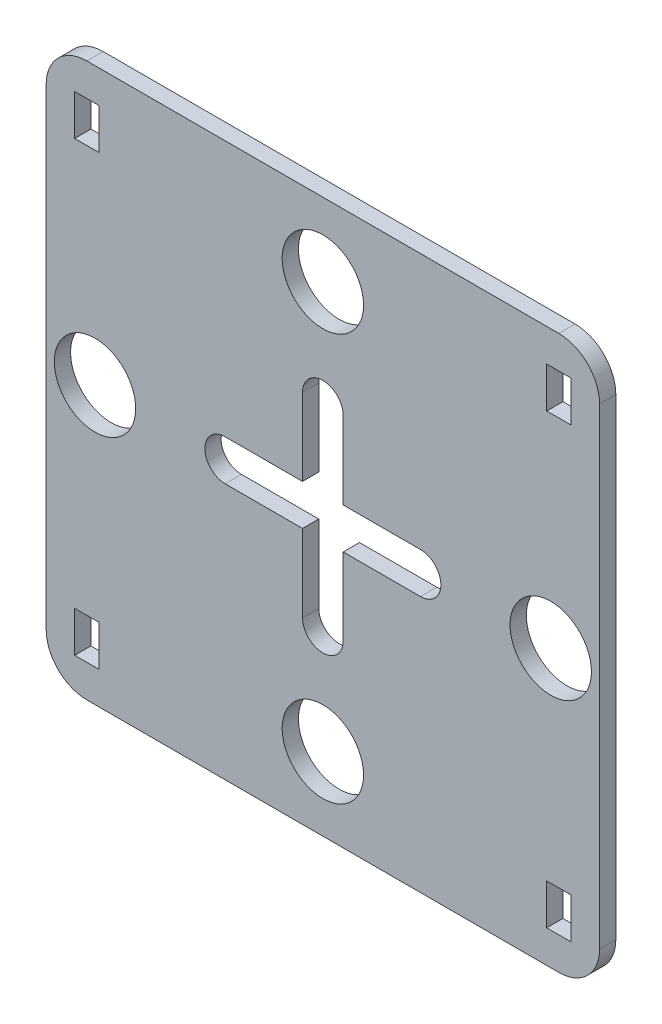
from build123d import *

# Parameters (mm, degrees)
SKETCH1_W           = 68
SKETCH1_H           = 68
SKETCH1_W_2         = 2
SKETCH1_H_2         = 5
SKETCH1_R           = 5
BOSS_EXTRUDE1_DEPTH = 2
FILLET2_R           = 5
FILLET3_R           = 5
FILLET4_R           = 5
FILLET5_R           = 5
SKETCH2_W           = 3
SKETCH2_H           = 5
CUT_EXTRUDE1_DEPTH  = 10


with BuildPart() as part:
    # Sketch1 → Boss-Extrude1 (new body)
    with BuildSketch(Plane.XY):
        Rectangle(SKETCH1_W, SKETCH1_H)
        with Locations((-29, -27.5)):
            Rectangle(SKETCH1_W_2, SKETCH1_H_2, mode=Mode.SUBTRACT)
        with Locations((0, -25)):
            Circle(SKETCH1_R, mode=Mode.SUBTRACT)
        with Locations((29, -27.5)):
            Rectangle(SKETCH1_W_2, SKETCH1_H_2, mode=Mode.SUBTRACT)
        with Locations((-28, 0)):
            Circle(SKETCH1_R, mode=Mode.SUBTRACT)
        with Locations((-29, 27.5)):
            Rectangle(SKETCH1_W_2, SKETCH1_H_2, mode=Mode.SUBTRACT)
        with BuildLine():
            ThreePointArc((-12, -2.5), (-14.5, 0), (-12, 2.5))
            Line((-12, 2.5), (-2.5, 2.5))
            Line((-2.5, 2.5), (-2.5, 12))
            ThreePointArc((-2.5, 12), (0, 14.5), (2.5, 12))
            Line((2.5, 12), (2.5, 2.5))
            Line((2.5, 2.5), (12, 2.5))
            ThreePointArc((12, 2.5), (14.5, 0), (12, -2.5))
            Line((12, -2.5), (2.5, -2.5))
            Line((2.5, -2.5), (2.5, -12))
            ThreePointArc((2.5, -12), (0, -14.5), (-2.5, -12))
            Line((-2.5, -12), (-2.5, -2.5))
            Line((-2.5, -2.5), (-12, -2.5))
        make_face(mode=Mode.SUBTRACT)
        with Locations((28, 0)):
            Circle(SKETCH1_R, mode=Mode.SUBTRACT)
        with Locations((0, 25)):
            Circle(SKETCH1_R, mode=Mode.SUBTRACT)
        with Locations((29, 27.5)):
            Rectangle(SKETCH1_W_2, SKETCH1_H_2, mode=Mode.SUBTRACT)
    extrude(amount=BOSS_EXTRUDE1_DEPTH)

    # Fillet2
    fillet2_edges = [part.edges().sort_by_distance(p)[0] for p in [
        (34, 34, 1),
    ]]
    fillet(fillet2_edges, radius=FILLET2_R)

    # Fillet3
    fillet3_edges = [part.edges().sort_by_distance(p)[0] for p in [
        (-34, 34, 1),
    ]]
    fillet(fillet3_edges, radius=FILLET3_R)

    # Fillet4
    fillet4_edges = [part.edges().sort_by_distance(p)[0] for p in [
        (-34, -34, 1),
    ]]
    fillet(fillet4_edges, radius=FILLET4_R)

    # Fillet5
    fillet5_edges = [part.edges().sort_by_distance(p)[0] for p in [
        (34, -34, 1),
    ]]
    fillet(fillet5_edges, radius=FILLET5_R)

    # Sketch2 → Cut-Extrude1 (cut)
    with BuildSketch(Plane.XY.offset(2)):
        with Locations((29, 27.5)):
            Rectangle(SKETCH2_W, SKETCH2_H)
        with Locations((-29, 27.5)):
            Rectangle(SKETCH2_W, SKETCH2_H)
        with Locations((29, -27.5)):
            Rectangle(SKETCH2_W, SKETCH2_H)
        with Locations((-29, -27.5)):
            Rectangle(SKETCH2_W, SKETCH2_H)
    extrude(amount=-CUT_EXTRUDE1_DEPTH, mode=Mode.SUBTRACT)


solid = part.part
